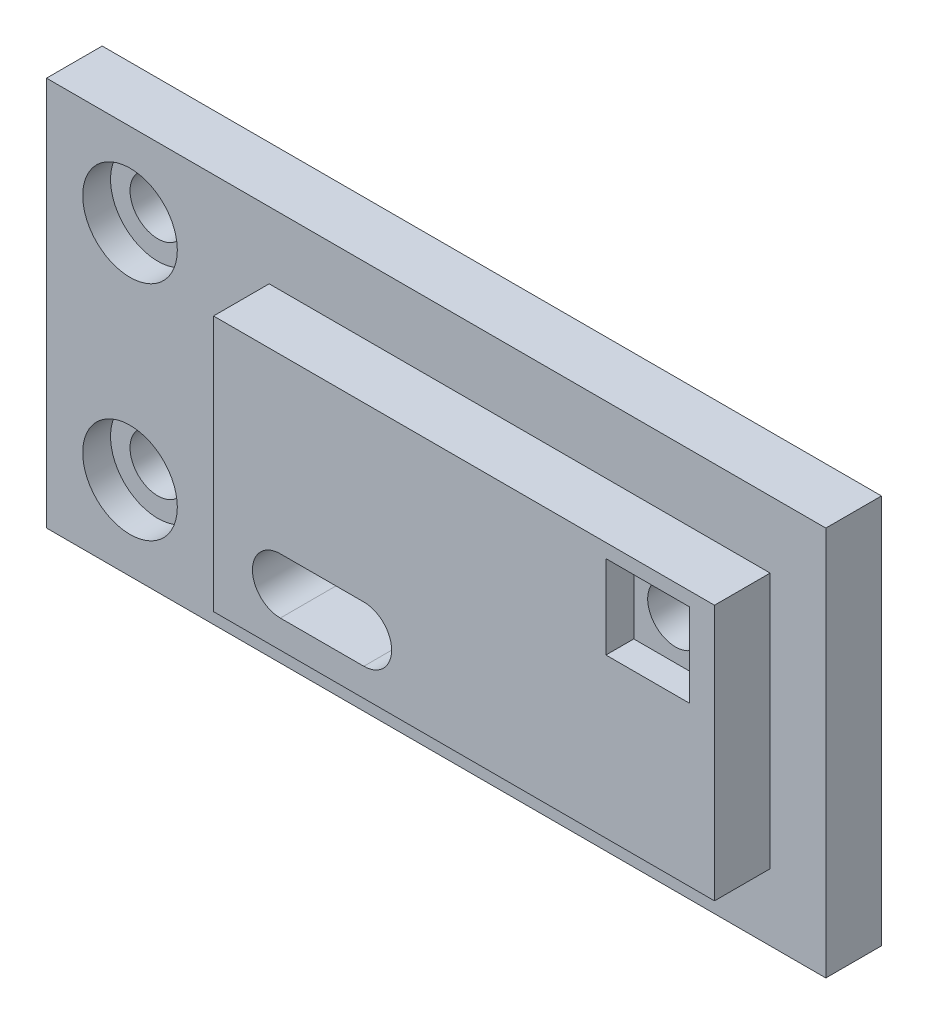
from build123d import *

# Parameters (mm, degrees)
ESQUISSE1_W             = 140
ESQUISSE1_H             = 70
ESQUISSE1_R             = 5
BOSS_EXTRU_1_DEPTH      = 10
ESQUISSE2_R             = 8.5
ENL_V_MAT_EXTRU_1_DEPTH = 5
ESQUISSE3_W             = 90
ESQUISSE3_H             = 46
BOSS_EXTRU_2_DEPTH      = 10
ESQUISSE4_R             = 5
ENL_V_MAT_EXTRU_2_DEPTH = 81.777472107
ESQUISSE5_W             = 15
ESQUISSE5_H             = 15
ENL_V_MAT_EXTRU_3_DEPTH = 5
ENL_V_MAT_EXTRU_4_DEPTH = 5


with BuildPart() as part:
    # Esquisse1 → Boss.-Extru.1 (new body)
    with BuildSketch(Plane.XY):
        Rectangle(ESQUISSE1_W, ESQUISSE1_H)
        with Locations((-55, 20)):
            Circle(ESQUISSE1_R, mode=Mode.SUBTRACT)
        with Locations((-55, -20)):
            Circle(ESQUISSE1_R, mode=Mode.SUBTRACT)
    extrude(amount=BOSS_EXTRU_1_DEPTH)

    # Esquisse2 → Enlèv. mat.-Extru.1 (cut)
    with BuildSketch(Plane.XY.offset(10)):
        with Locations((-55, 20)):
            Circle(ESQUISSE2_R)
        with Locations((-55, -20)):
            Circle(ESQUISSE2_R)
    extrude(amount=-ENL_V_MAT_EXTRU_1_DEPTH, mode=Mode.SUBTRACT)

    # Esquisse3 → Boss.-Extru.2 (add)
    with BuildSketch(Plane.XY.offset(10)):
        with Locations((15, 0)):
            Rectangle(ESQUISSE3_W, ESQUISSE3_H)
    extrude(amount=BOSS_EXTRU_2_DEPTH)

    # Esquisse4 → Enlèv. mat.-Extru.2 (cut, through all)
    with BuildSketch(Plane.XY.offset(20)):
        with Locations((48, 13)):
            Circle(ESQUISSE4_R)
        with BuildLine():
            Line((-18, -8), (-3, -8))
            ThreePointArc((-3, -8), (2, -13), (-3, -18))
            Line((-3, -18), (-18, -18))
            ThreePointArc((-18, -18), (-23, -13), (-18, -8))
        make_face()
    extrude(amount=-ENL_V_MAT_EXTRU_2_DEPTH, mode=Mode.SUBTRACT)

    # Esquisse5 → Enlèv. mat.-Extru.3 (cut)
    with BuildSketch(Plane.XY.offset(20)):
        with Locations((48, 13)):
            Rectangle(ESQUISSE5_W, ESQUISSE5_H)
    extrude(amount=-ENL_V_MAT_EXTRU_3_DEPTH, mode=Mode.SUBTRACT)

    # Esquisse6 → Enlèv. mat.-Extru.4 (cut)
    with BuildSketch(Plane(origin=(0, 0, 0), x_dir=(-1, 0, 0), z_dir=(0, 0, -1))):
        with BuildLine():
            Line((18, -20), (3, -20))
            ThreePointArc((3, -20), (-4, -13), (3, -6))
            Line((3, -6), (18, -6))
            ThreePointArc((18, -6), (25, -13), (18, -20))
        make_face()
    extrude(amount=-ENL_V_MAT_EXTRU_4_DEPTH, mode=Mode.SUBTRACT)


solid = part.part
